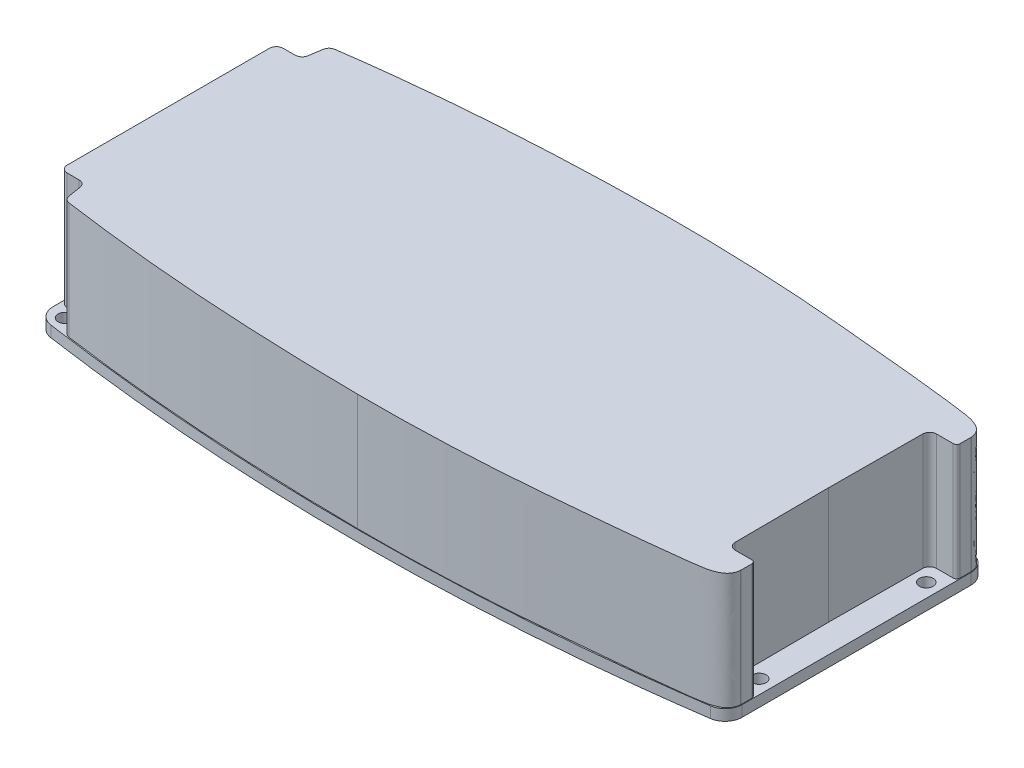
from build123d import *

# Parameters (mm, degrees)
BOSS_EXTRUDE1_DEPTH = 3.2
BOSS_EXTRUDE2_DEPTH = 37
SKETCH5_R           = 2
CUT_EXTRUDE1_DEPTH  = 115.749466386


with BuildPart() as part:
    # Sketch1 → Boss-Extrude1 (new body)
    with BuildSketch(Plane(origin=(0, 0, 0), x_dir=(1, 0, 0), z_dir=(0, 1, 0))):
        with BuildLine():
            Line((-100, 33.180363606), (-100, -33.180363606))
            ThreePointArc((-100, -33.180363606), (-98.778407027, -36.45506059), (-95.710543866, -38.129618845))
            add(Edge.make_bspline(
                [(-95.710543866, -38.129618845), (-63.807029244, -42.709872948), (0, -47.290127052), (63.807029244, -42.709872948), (95.710543866, -38.129618845)],
                knots=[0.021447281, 0.021447281, 0.021447281, 0.021447281, 0.5, 0.978552719, 0.978552719, 0.978552719, 0.978552719], degree=3))
            ThreePointArc((95.710543866, -38.129618845), (98.778407027, -36.45506059), (100, -33.180363606))
            Line((100, -33.180363606), (100, 33.180363606))
            ThreePointArc((100, 33.180363606), (98.778407027, 36.45506059), (95.710543866, 38.129618845))
            add(Edge.make_bspline(
                [(-95.710543866, 38.129618845), (-63.807029244, 42.709872948), (0, 47.290127052), (63.807029244, 42.709872948), (95.710543866, 38.129618845)],
                knots=[0.021447281, 0.021447281, 0.021447281, 0.021447281, 0.5, 0.978552719, 0.978552719, 0.978552719, 0.978552719], degree=3))
            ThreePointArc((-95.710543866, 38.129618845), (-98.778407027, 36.45506059), (-100, 33.180363606))
        make_face()
    extrude(amount=BOSS_EXTRUDE1_DEPTH)

    # Sketch5 → Cut-Extrude1 (cut, through all)
    with BuildSketch(Plane(origin=(0, 3.2, 0), x_dir=(1, 0, 0), z_dir=(0, 1, 0))):
        with Locations(Location((-95.452729766, 34.287861844, 0), (0, 0, 270))):
            Circle(SKETCH5_R)
        with Locations(Location((-95.452729766, -34.287861844, 0), (0, 0, 90))):
            Circle(SKETCH5_R)
        with Locations(Location((95.99050817, 24.235706528, 0), (0, 0, 270))):
            Circle(SKETCH5_R)
        with Locations(Location((95.99050817, -24.235706528, 0), (0, 0, 90))):
            Circle(SKETCH5_R)
    extrude(amount=-CUT_EXTRUDE1_DEPTH, mode=Mode.SUBTRACT)


with BuildPart() as body_2:
    # Sketch4 → Boss-Extrude2 (new body)
    with BuildSketch(Plane(origin=(0, 0, 0), x_dir=(1, 0, 0), z_dir=(0, 1, 0))):
        with BuildLine():
            Line((99.836632729, -33.387386203), (99.836632729, -30.42884553))
            Line((99.836632729, -30.42884553), (99.836632729, -30.221958284))
            ThreePointArc((99.836632729, -30.221958284), (99.54373951, -29.514851503), (98.836632729, -29.221958284))
            Line((98.836632729, -29.221958284), (93.991628276, -29.221958284))
            ThreePointArc((93.991628276, -29.221958284), (92.581445654, -28.64019133), (91.991660681, -27.233343257))
            Line((91.991660681, -27.233343257), (91.836632729, 0))
            Line((91.836632729, 0), (91.991660681, 27.233343257))
            ThreePointArc((91.991660681, 27.233343257), (92.581445654, 28.64019133), (93.991628276, 29.221958284))
            Line((93.991628276, 29.221958284), (98.836632729, 29.221958284))
            ThreePointArc((98.836632729, 29.221958284), (99.54373951, 29.514851503), (99.836632729, 30.221958284))
            Line((99.836632729, 30.221958284), (99.836632729, 30.42884553))
            Line((99.836632729, 30.42884553), (99.836632729, 33.387386203))
            ThreePointArc((99.836632729, 33.387386203), (99.834773836, 33.473595926), (99.829200612, 33.559645394))
            add(Edge.make_bspline(
                [(0, 44.802805821), (13.836630515, 44.914508245), (34.369021475, 44.256257564), (64.995120664, 41.430112577), (81.200098897, 39.945879291), (95.364485464, 38.069678587), (98.681175098, 36.553953762), (99.721833489, 34.801589465), (99.829200612, 33.559645394)],
                knots=[0, 0, 0, 0, 0.456142612, 0.549379817, 0.88981736, 0.935787829, 0.966529808, 0.99916057, 0.99916057, 0.99916057, 0.99916057], degree=3))
            add(Edge.make_bspline(
                [(-89.982219157, 38.581536757), (-75.42343033, 40.657136076), (-45.867040318, 43.63406662), (-15.434719566, 44.669101832), (0, 44.802805821)],
                knots=[0.01182412, 0.01182412, 0.01182412, 0.01182412, 0.50591206, 1, 1, 1, 1], degree=3))
            ThreePointArc((-89.982219157, 38.581536757), (-91.101816056, 38.028001634), (-91.674716885, 36.918189492))
            Line((-91.674716885, 36.918189492), (-92.297533234, 33.033797351))
            ThreePointArc((-92.297533234, 33.033797351), (-92.974890422, 31.828357905), (-94.272380865, 31.350429489))
            Line((-94.272380865, 31.350429489), (-97.749929341, 31.350552349))
            ThreePointArc((-97.749929341, 31.350552349), (-99.16418858, 30.764790895), (-99.75, 29.350552351))
            Line((-99.75, 29.350552351), (-99.75, -29.350552351))
            ThreePointArc((-99.75, -29.350552351), (-99.16418858, -30.764790895), (-97.749929341, -31.350552349))
            Line((-97.749929341, -31.350552349), (-94.272380865, -31.350429489))
            ThreePointArc((-94.272380865, -31.350429489), (-92.974890422, -31.828357905), (-92.297533234, -33.033797351))
            Line((-92.297533234, -33.033797351), (-91.674716885, -36.918189492))
            ThreePointArc((-91.674716885, -36.918189492), (-91.101816056, -38.028001634), (-89.982219157, -38.581536757))
            add(Edge.make_bspline(
                [(-89.982219157, -38.581536757), (-75.42343033, -40.657136076), (-45.867040318, -43.63406662), (-15.434719566, -44.669101832), (0, -44.802805821)],
                knots=[0.01182412, 0.01182412, 0.01182412, 0.01182412, 0.50591206, 1, 1, 1, 1], degree=3))
            add(Edge.make_bspline(
                [(0, -44.802805821), (13.836630515, -44.914508245), (34.369021475, -44.256257564), (64.995120664, -41.430112577), (81.200098897, -39.945879291), (95.364485464, -38.069678587), (98.681175098, -36.553953762), (99.721833489, -34.801589465), (99.829200612, -33.559645394)],
                knots=[0, 0, 0, 0, 0.456142612, 0.549379817, 0.88981736, 0.935787829, 0.966529808, 0.99916057, 0.99916057, 0.99916057, 0.99916057], degree=3))
            ThreePointArc((99.829200612, -33.559645394), (99.834773836, -33.473595926), (99.836632729, -33.387386203))
        make_face()
    extrude(amount=BOSS_EXTRUDE2_DEPTH)


solid = Compound([part.part, body_2.part])
